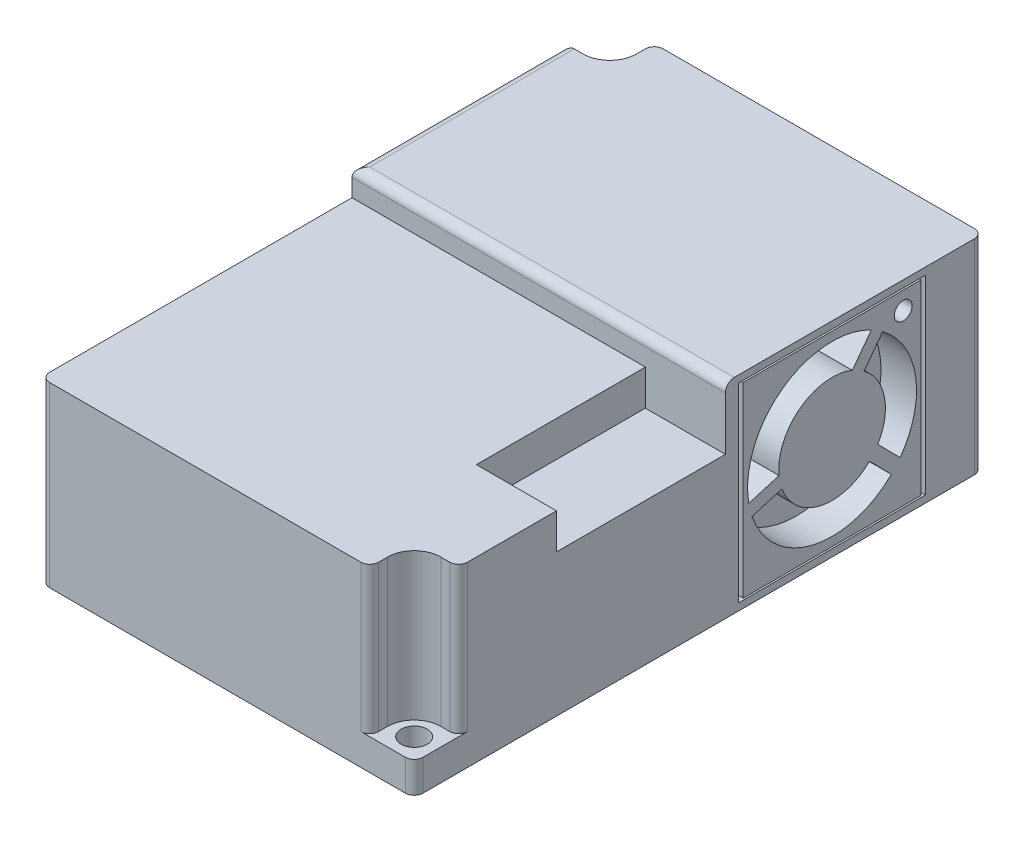
from build123d import *

# Parameters (mm, degrees)
SKETCH1_W           = 42
SKETCH1_H           = 64
BOSS_EXTRUDE1_DEPTH = 20
SKETCH4_W           = 42
SKETCH4_H           = 29
BOSS_EXTRUDE2_DEPTH = 3
SKETCH5_W           = 9
SKETCH5_H           = 19
CUT_EXTRUDE1_DEPTH  = 4
CUT_EXTRUDE2_REACH  = 50.154
CUT_EXTRUDE2_START  = 3.5
SKETCH6_W           = 5
SKETCH6_H           = 5
FILLET1_R           = 3
FILLET2_R           = 1
SKETCH7_R           = 1.471142405
SKETCH7_R_2         = 1.415504474
CUT_EXTRUDE3_DEPTH  = 43.956373217
SKETCH8_W           = 21
SKETCH8_H           = 21.4
SKETCH8_W_2         = 20
SKETCH8_H_2         = 21
SKETCH8_R           = 1
CUT_EXTRUDE5_DEPTH  = 4
SKETCH10_W          = 11
SKETCH10_H          = 4.5
CUT_EXTRUDE6_DEPTH  = 4


with BuildPart() as part:
    # Sketch1 → Boss-Extrude1 (new body)
    with BuildSketch(Plane(origin=(0, 0, 0), x_dir=(1, 0, 0), z_dir=(0, 1, 0))):
        Rectangle(SKETCH1_W, SKETCH1_H)
    extrude(amount=BOSS_EXTRUDE1_DEPTH)

    # Sketch4 → Boss-Extrude2 (add)
    with BuildSketch(Plane(origin=(0, 20, 0), x_dir=(1, 0, 0), z_dir=(0, 1, 0))):
        with Locations((0, 17.5)):
            Rectangle(SKETCH4_W, SKETCH4_H)
    extrude(amount=BOSS_EXTRUDE2_DEPTH)

    # Sketch5 → Cut-Extrude1 (cut)
    with BuildSketch(Plane(origin=(0, 20, 0), x_dir=(1, 0, 0), z_dir=(0, 1, 0))):
        with Locations((16.5, -6.5)):
            Rectangle(SKETCH5_W, SKETCH5_H)
    extrude(amount=-CUT_EXTRUDE1_DEPTH, mode=Mode.SUBTRACT)

    # Sketch6 → Cut-Extrude2 (cut, up to next)
    with BuildSketch(Plane(origin=(0, 0, 0), x_dir=(1, 0, 0), z_dir=(0, 1, 0)).offset(CUT_EXTRUDE2_START), mode=Mode.PRIVATE) as cut_extrude2_sk1:
        with Locations((-18.5, 29.5)):
            Rectangle(SKETCH6_W, SKETCH6_H)
    cut_extrude2_tool1 = extrude(cut_extrude2_sk1.sketch, amount=CUT_EXTRUDE2_REACH, mode=Mode.PRIVATE) & part.part
    # Sketch6 → Cut-Extrude2 (cut, up to next)
    with BuildSketch(Plane(origin=(0, 0, 0), x_dir=(1, 0, 0), z_dir=(0, 1, 0)).offset(CUT_EXTRUDE2_START), mode=Mode.PRIVATE) as cut_extrude2_sk2:
        with Locations((18.5, -29.5)):
            Rectangle(SKETCH6_W, SKETCH6_H)
    cut_extrude2_tool2 = extrude(cut_extrude2_sk2.sketch, amount=CUT_EXTRUDE2_REACH, mode=Mode.PRIVATE) & part.part
    add(cut_extrude2_tool1.solids().sort_by_distance((-18.5, 3.5, -29.5))[0], mode=Mode.SUBTRACT)
    add(cut_extrude2_tool2.solids().sort_by_distance((18.5, 3.5, 29.5))[0], mode=Mode.SUBTRACT)

    # Fillet1
    fillet1_edges = [part.edges().sort_by_distance(p)[0] for p in [
        (-16, 13.25, -27),
        (16, 11.75, 27),
    ]]
    fillet(fillet1_edges, radius=FILLET1_R)

    # Fillet2
    fillet2_edges = [part.edges().sort_by_distance(p)[0] for p in [
        (21, 1.75, 32),
        (-21, 1.75, -32),
        (-21, 13.25, -27),
        (-16, 13.25, -32),
        (21, 11.5, -32),
        (-21, 10, 32),
        (16, 11.75, 32),
        (21, 11.75, 27),
        (0, 23, -3),
        (-21, 23, -15),
    ]]
    fillet(fillet2_edges, radius=FILLET2_R)

    # Sketch7 → Cut-Extrude3 (cut, through all)
    with BuildSketch(Plane(origin=(0, 3.5, 0), x_dir=(1, 0, 0), z_dir=(0, 1, 0))):
        with Locations(Location((18.5, -29.5, 0), (0, 0, 270))):
            Circle(SKETCH7_R)
        with Locations(Location((-18.5, 29.5, 0), (0, 0, 270))):
            Circle(SKETCH7_R_2)
    extrude(amount=-CUT_EXTRUDE3_DEPTH, mode=Mode.SUBTRACT)

    # Sketch8 → Cut-Extrude5 (cut)
    # profile 1 of 7: a face of its own
    with BuildSketch(Plane(origin=(21, 0, 0), x_dir=(0, 0, -1), z_dir=(1, 0, 0))):
        with Locations((15, 11.5)):
            Rectangle(SKETCH8_W, SKETCH8_H)
        with Locations((15, 11.5)):
            Rectangle(SKETCH8_W_2, SKETCH8_H_2, mode=Mode.SUBTRACT)
    # profile 2 of 7: a face of its own
    with BuildSketch(Plane(origin=(21, 0, 0), x_dir=(0, 0, -1), z_dir=(1, 0, 0))):
        with Locations((23, 20)):
            Circle(SKETCH8_R)
    # profile 3 of 7: a face of its own
    with BuildSketch(Plane(origin=(21, 0, 0), x_dir=(0, 0, -1), z_dir=(1, 0, 0))):
        with BuildLine():
            ThreePointArc((19.415599916, 19.911449184), (17.273898937, 20.723848634), (15, 21))
            Line((15, 21), (15, 17.5))
            ThreePointArc((15, 17.5), (16.160499883, 17.386700266), (17.277171656, 17.051080008))
            Line((17.277171656, 17.051080008), (19.415599916, 19.911449184))
        make_face()
    # profile 4 of 7: a face of its own
    with BuildSketch(Plane(origin=(21, 0, 0), x_dir=(0, 0, -1), z_dir=(1, 0, 0))):
        with BuildLine():
            Line((15, 17.5), (15, 21))
            ThreePointArc((15, 21), (7.742797617, 17.63049864), (5.633627508, 9.912213384))
            Line((5.633627508, 9.912213384), (9.02780956, 10.922989297))
            ThreePointArc((9.02780956, 10.922989297), (10.558037359, 15.533480865), (15, 17.5))
        make_face()
    # profile 5 of 7: a face of its own
    with BuildSketch(Plane(origin=(21, 0, 0), x_dir=(0, 0, -1), z_dir=(1, 0, 0))):
        with BuildLine():
            ThreePointArc((6.000737249, 8.456437952), (9.462123126, 3.781067449), (15, 2))
            Line((15, 2), (15, 5.5))
            ThreePointArc((15, 5.5), (11.554812633, 6.587700741), (9.358736217, 9.456438665))
            Line((9.358736217, 9.456438665), (6.000737249, 8.456437952))
        make_face()
    # profile 6 of 7: a face of its own
    with BuildSketch(Plane(origin=(21, 0, 0), x_dir=(0, 0, -1), z_dir=(1, 0, 0))):
        with BuildLine():
            Line((15, 5.5), (15, 2))
            ThreePointArc((15, 2), (18.598182651, 2.707782896), (21.660211168, 4.725667029))
            Line((21.660211168, 4.725667029), (19.206449159, 7.221473913))
            ThreePointArc((19.206449159, 7.221473913), (17.272536411, 5.947020776), (15, 5.5))
        make_face()
    # profile 7 of 7: a face of its own
    with BuildSketch(Plane(origin=(21, 0, 0), x_dir=(0, 0, -1), z_dir=(1, 0, 0))):
        with BuildLine():
            Line((20.142508406, 8.40894722), (22.646296664, 5.862256894))
            ThreePointArc((22.646296664, 5.862256894), (24.397892993, 12.889103053), (20.688333963, 19.108735554))
            Line((20.688333963, 19.108735554), (18.592631977, 16.305517192))
            ThreePointArc((18.592631977, 16.305517192), (20.887667085, 12.655584827), (20.142508406, 8.40894722))
        make_face()
    extrude(amount=-CUT_EXTRUDE5_DEPTH, mode=Mode.SUBTRACT)

    # Sketch10 → Cut-Extrude6 (cut)
    with BuildSketch(Plane.ZY.offset(21)):
        with Locations((-16.5, 17.75)):
            Rectangle(SKETCH10_W, SKETCH10_H)
    extrude(amount=-CUT_EXTRUDE6_DEPTH, mode=Mode.SUBTRACT)


solid = part.part
